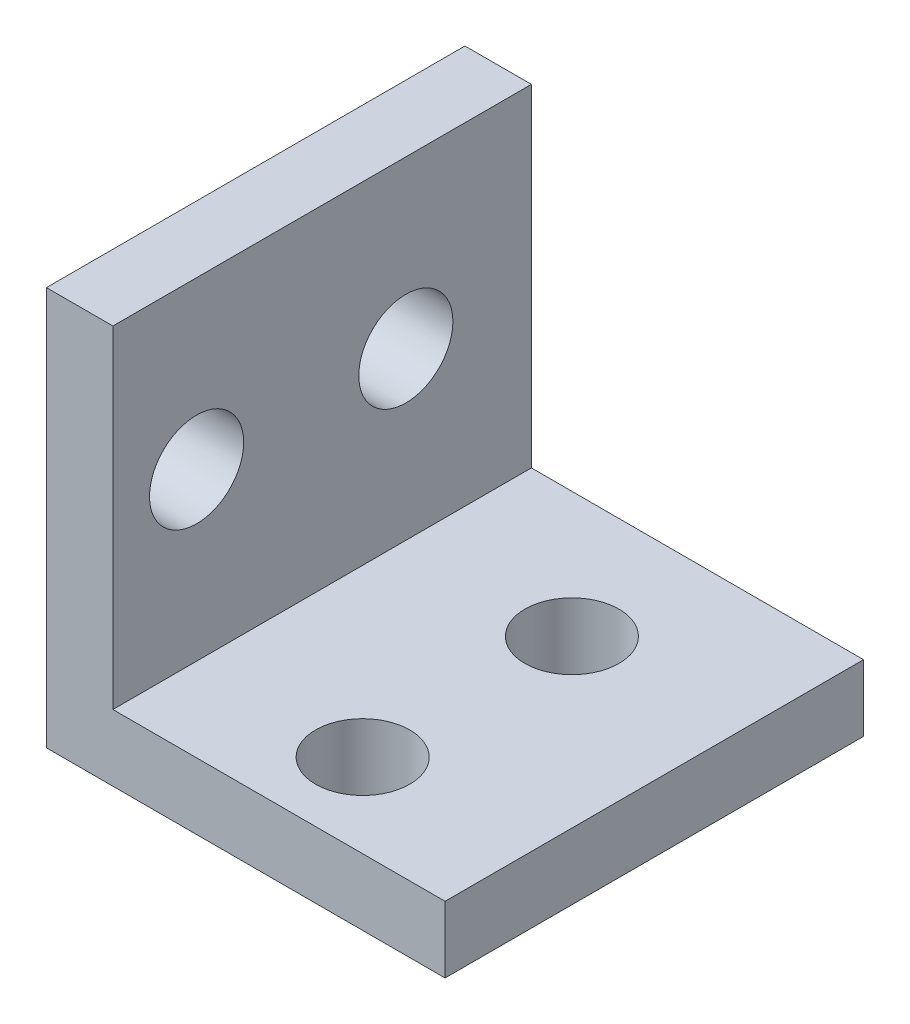
from build123d import *

# Parameters (mm, degrees)
SK_ALA_1_W           = 19.05
SK_ALA_1_H           = 3.175
ALA_1_DEPTH          = 20
SK_ALA_2_W           = 3.175
SK_ALA_2_H           = 19.05
ALA_2_DEPTH          = 20
SK_BARRENOS_ALA_1_R  = 2.25
BARRENOS_ALA_1_DEPTH = 3.175
SK_BARRENOS_ALA_2_R  = 2.25
BARRENOS_ALA_2_DEPTH = 3.175


with BuildPart() as part:
    # Sk_Ala_1 → Ala_1 (new body)
    with BuildSketch(Plane.XY):
        with Locations((9.525, 1.5875)):
            Rectangle(SK_ALA_1_W, SK_ALA_1_H)
    extrude(amount=ALA_1_DEPTH)

    # Sk_Ala_2 → Ala_2 (add)
    with BuildSketch(Plane.XY):
        with Locations((1.5875, 9.525)):
            Rectangle(SK_ALA_2_W, SK_ALA_2_H)
    extrude(amount=ALA_2_DEPTH)

    # Sk_Barrenos_ala_1 → Barrenos_ala_1 (cut)
    with BuildSketch(Plane(origin=(0, 0, 0), x_dir=(1, 0, 0), z_dir=(0, 1, 0))):
        with Locations(Location((11.1125, -6, 0), (0, 0, 270))):
            Circle(SK_BARRENOS_ALA_1_R)
        with Locations(Location((11.1125, -16, 0), (0, 0, 270))):
            Circle(SK_BARRENOS_ALA_1_R)
    extrude(amount=BARRENOS_ALA_1_DEPTH, mode=Mode.SUBTRACT)

    # Sk_Barrenos_ala_2 → Barrenos_ala_2 (cut)
    with BuildSketch(Plane(origin=(0, 0, 0), x_dir=(0, 0, -1), z_dir=(1, 0, 0))):
        with Locations((-6, 11.1125)):
            Circle(SK_BARRENOS_ALA_2_R)
        with Locations((-16, 11.1125)):
            Circle(SK_BARRENOS_ALA_2_R)
    extrude(amount=BARRENOS_ALA_2_DEPTH, mode=Mode.SUBTRACT)


solid = part.part
